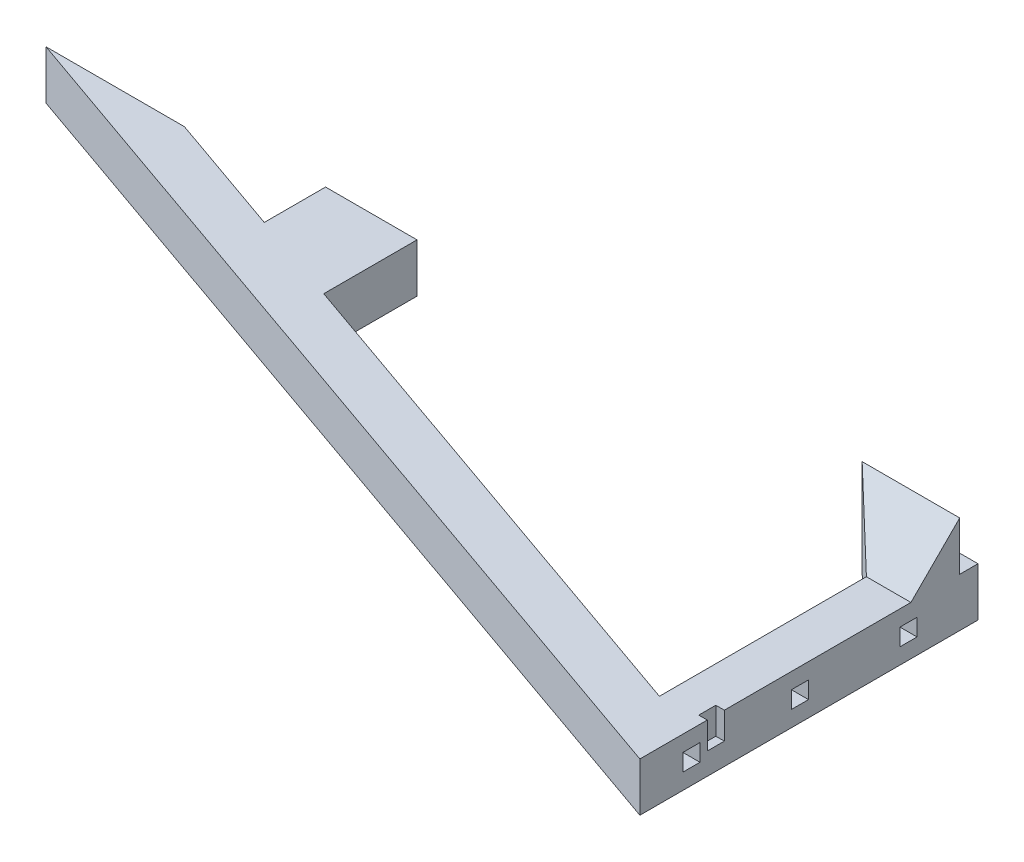
from build123d import *

# Parameters (mm, degrees)
P_IDAT_VYSUNUT_M1_DEPTH  = 8
SKICA3_W                 = 1.4
SKICA3_H                 = 2.8
ODEBRAT_VYSUNUT_M1_DEPTH = 4.4
P_IDAT_START             = 8
SKICA5_W                 = 16
SKICA5_H                 = 8
P_IDAT_VYSUNUT_M2_DEPTH  = 16
ODEBRAT_VYSUNUT_M3_DEPTH = 161.57934176
ODEBRAT_VYSUNUT_M4_DEPTH = 161.57934176
SKICA4_W                 = 2.8
SKICA4_H                 = 2.8
ODEBRAT_VYSUNUT_M2_DEPTH = 4.4


with BuildPart() as part:
    # Skica2 → Přidat vysunutím1 (new body)
    with BuildSketch(Plane(origin=(0, 0, 0), x_dir=(1, 0, 0), z_dir=(0, 1, 0))):
        Polygon((0, 0), (0, -55.45), (-149.85, -3), (-127.147799643, -3), (-107, -10.052066008), (-107, 0), (-92, 0), (-92, -15.302316258), (-7.3, -44.948729338), (-7.3, 0), align=None)
    extrude(amount=P_IDAT_VYSUNUT_M1_DEPTH)

    # Skica3 → Odebrat vysunutím1 (cut)
    with BuildSketch(Plane(origin=(0, 8, 0), x_dir=(1, 0, 0), z_dir=(0, 1, 0))):
        with Locations((-0.7, -43)):
            Rectangle(SKICA3_W, SKICA3_H)
    extrude(amount=-ODEBRAT_VYSUNUT_M1_DEPTH, mode=Mode.SUBTRACT)

    # Skica5 → Přidat vysunutím2 (add)
    with BuildSketch(Plane(origin=(0, 8, 0), x_dir=(1, 0, 0), z_dir=(0, 1, 0)).offset(P_IDAT_START)):
        with Locations((-8, -7)):
            Rectangle(SKICA5_W, SKICA5_H)
    extrude(amount=-P_IDAT_VYSUNUT_M2_DEPTH)

    # Skica6 → Odebrat vysunutím3 (cut, through all)
    with BuildSketch(Plane(origin=(0, 0, 0), x_dir=(0, 0, -1), z_dir=(1, 0, 0))):
        Polygon((-11, 8), (-11, 16), (-3, 16), align=None)
    extrude(amount=-ODEBRAT_VYSUNUT_M3_DEPTH, mode=Mode.SUBTRACT)

    # Skica7 → Odebrat vysunutím4 (cut, through all)
    with BuildSketch(Plane.XZ):
        Polygon((-16, 3), (-16, 11), (-7.3, 11), align=None)
    extrude(amount=-ODEBRAT_VYSUNUT_M4_DEPTH, mode=Mode.SUBTRACT)

    # Skica4 → Odebrat vysunutím2 (cut)
    with BuildSketch(Plane(origin=(0, 0, 0), x_dir=(0, 0, -1), z_dir=(1, 0, 0))):
        with Locations((-47, 4)):
            Rectangle(SKICA4_W, SKICA4_H)
        with Locations((-29.2, 4)):
            Rectangle(SKICA4_W, SKICA4_H)
        with Locations((-11.4, 4)):
            Rectangle(SKICA4_W, SKICA4_H)
    extrude(amount=-ODEBRAT_VYSUNUT_M2_DEPTH, mode=Mode.SUBTRACT)


solid = part.part
